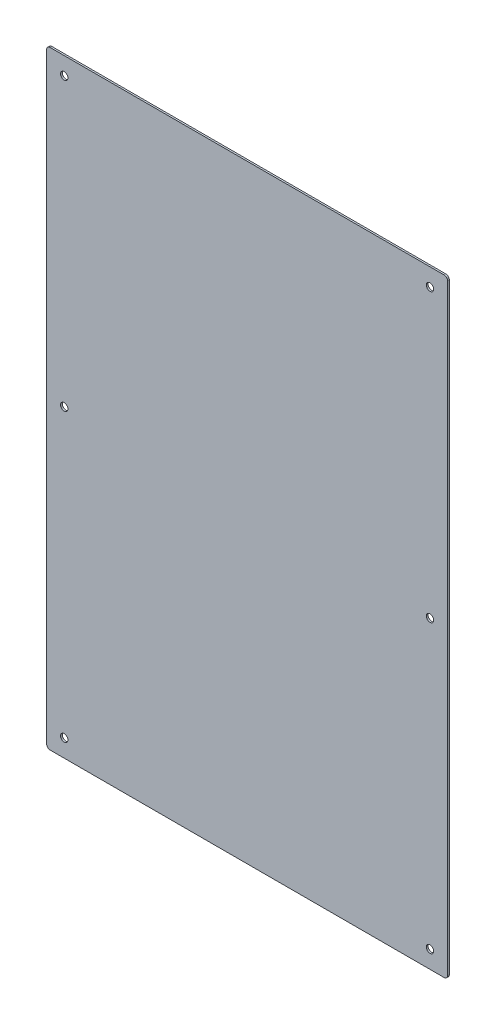
from build123d import *

# Parameters (mm, degrees)
SKETCH_1_R      = 2.1
EXTRUDE_1_DEPTH = 1


with BuildPart() as part:
    # Эскиз1 → Вытянуть1 (new body)
    with BuildSketch(Plane.XY):
        with BuildLine():
            Line((-112, -173), (112, -173))
            ThreePointArc((112, -173), (113.414213562, -172.414213562), (114, -171))
            Line((114, -171), (114, 171))
            ThreePointArc((114, 171), (113.414213562, 172.414213562), (112, 173))
            Line((112, 173), (-112, 173))
            ThreePointArc((-112, 173), (-113.414213562, 172.414213562), (-114, 171))
            Line((-114, 171), (-114, -171))
            ThreePointArc((-114, -171), (-113.414213562, -172.414213562), (-112, -173))
        make_face()
        with Locations((-104, 163)):
            Circle(SKETCH_1_R, mode=Mode.SUBTRACT)
        with Locations((-104, 0)):
            Circle(SKETCH_1_R, mode=Mode.SUBTRACT)
        with Locations(Location((-104, -163, 0), (0, 0, 180))):
            Circle(SKETCH_1_R, mode=Mode.SUBTRACT)
        with Locations((104, -163)):
            Circle(SKETCH_1_R, mode=Mode.SUBTRACT)
        with Locations(Location((104, 0, 0), (0, 0, 180))):
            Circle(SKETCH_1_R, mode=Mode.SUBTRACT)
        with Locations(Location((104, 163, 0), (0, 0, 180))):
            Circle(SKETCH_1_R, mode=Mode.SUBTRACT)
    extrude(amount=EXTRUDE_1_DEPTH)


solid = part.part
